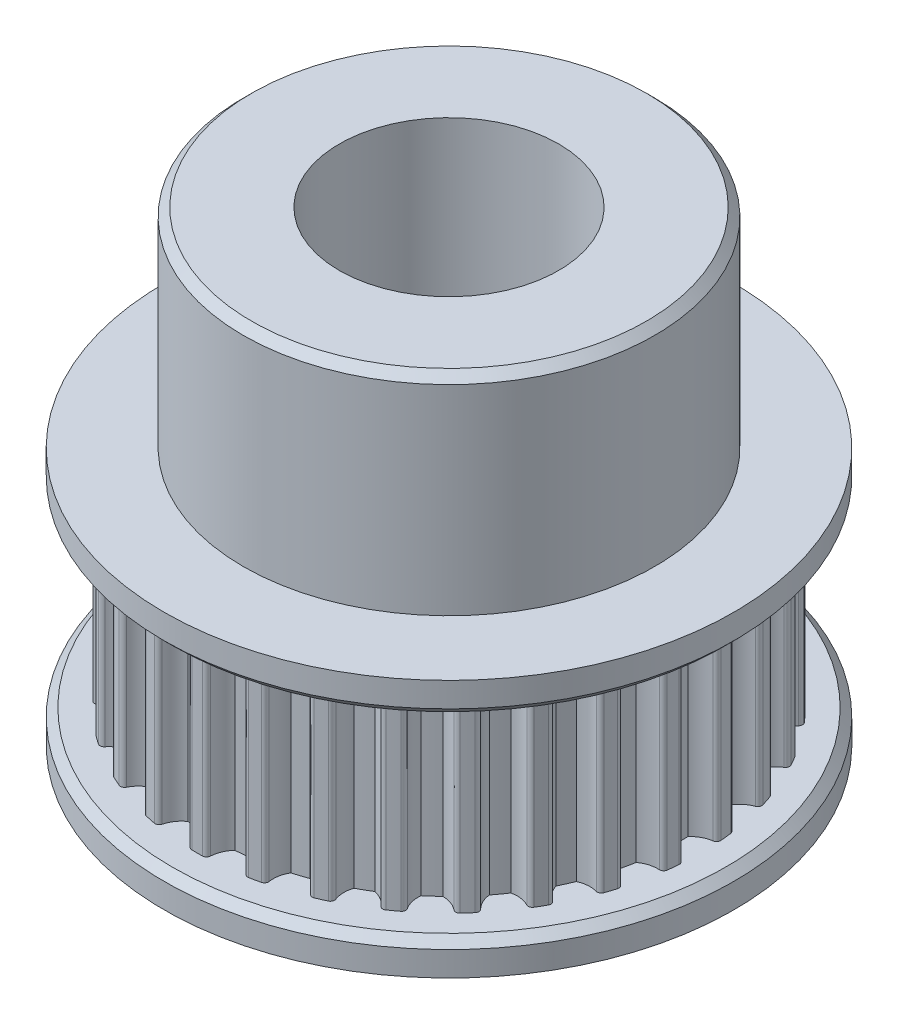
from build123d import *

# Parameters (mm, degrees)
BOSS_EXTRUDE1_DEPTH     = 7
SKETCH2_R               = 8.436
BOSS_EXTRUDE2_DEPTH     = 7
CIRPATTERN3_COUNT       = 30
SKETCH3_R               = 10.386
BOSS_EXTRUDE3_DEPTH     = 1.2
BOSS_EXTRUDE4_START     = 1.2
SKETCH4_R               = 10.386
BOSS_EXTRUDE4_DEPTH     = 1.2
SKETCH12_R              = 7.5
BOSS_EXTRUDE10_DEPTH    = 7.6
CUT_EXTRUDE1_DEPTH      = 18.438405661
CUT_EXTRUDE1_DEPTH_BACK = 18.438405661
SKETCH5_R               = 4
CHAMFER1_SIZE           = 0.3


with BuildPart() as part:
    # Sketch1 → Boss-Extrude1 (new body)
    with BuildSketch(Plane(origin=(0, 0, 0), x_dir=(1, 0, 0), z_dir=(0, 1, 0))):
        with BuildLine():
            ThreePointArc((-0.602259132, 8.41447443), (0, 8.436), (0.602259132, 8.41447443))
            ThreePointArc((0.602259132, 8.41447443), (0.417922536, 8.705053913), (0.343002255, 9.04091604))
            ThreePointArc((0.343002255, 9.04091604), (0.297887195, 9.141327917), (0.196371375, 9.183900821))
            ThreePointArc((0.196371375, 9.183900821), (0, 9.186), (-0.196371375, 9.183900821))
            ThreePointArc((-0.196371375, 9.183900821), (-0.297887195, 9.141327917), (-0.343002255, 9.04091604))
            ThreePointArc((-0.343002255, 9.04091604), (-0.417922536, 8.705053913), (-0.602259132, 8.41447443))
        make_face()
    boss_extrude1 = extrude(amount=BOSS_EXTRUDE1_DEPTH)

    # Sketch2 → Boss-Extrude2 (add)
    with BuildSketch(Plane.XZ):
        Circle(SKETCH2_R)
    extrude(amount=-BOSS_EXTRUDE2_DEPTH)

    # CirPattern3: Boss-Extrude1 ×30 about axis
    cirpattern3_axis = Axis((0, 0, 0), (0, 1, 0))
    for i in range(1, CIRPATTERN3_COUNT):
        add(boss_extrude1.rotate(cirpattern3_axis, i * 360 / CIRPATTERN3_COUNT))

    # Sketch3 → Boss-Extrude3 (add)
    with BuildSketch(Plane(origin=(0, 7, 0), x_dir=(1, 0, 0), z_dir=(0, 1, 0))):
        with Locations(Location((0, 0, 0), (0, 0, 270))):
            Circle(SKETCH3_R)
    extrude(amount=BOSS_EXTRUDE3_DEPTH)

    # Sketch4 → Boss-Extrude4 (add)
    with BuildSketch(Plane.XZ.offset(BOSS_EXTRUDE4_START)):
        with Locations(Location((0, 0, 0), (0, 0, 90))):
            Circle(SKETCH4_R)
    extrude(amount=-BOSS_EXTRUDE4_DEPTH)

    # Sketch12 → Boss-Extrude10 (add)
    with BuildSketch(Plane(origin=(0, 8.2, 0), x_dir=(1, 0, 0), z_dir=(0, 1, 0))):
        with Locations(Location((0, 0, 0), (0, 0, 90))):
            Circle(SKETCH12_R)
    extrude(amount=BOSS_EXTRUDE10_DEPTH)

    # Sketch5 → Cut-Extrude1 (cut, two sides: drawn at the far end of the back side and taken through both)
    with BuildSketch(Plane(origin=(0, 8.2, 0), x_dir=(1, 0, 0), z_dir=(0, 1, 0)).offset(-CUT_EXTRUDE1_DEPTH_BACK)):
        with Locations(Location((0, 0, 0), (0, 0, 270))):
            Circle(SKETCH5_R)
    extrude(amount=CUT_EXTRUDE1_DEPTH + CUT_EXTRUDE1_DEPTH_BACK, mode=Mode.SUBTRACT)

    # Chamfer1
    chamfer1_edges = [part.edges().sort_by_distance(p)[0] for p in [
        (0, 7, -10.386),
        (0, 0, -10.386),
        (0, 15.8, 7.5),
    ]]
    chamfer(chamfer1_edges, length=CHAMFER1_SIZE)


solid = part.part
